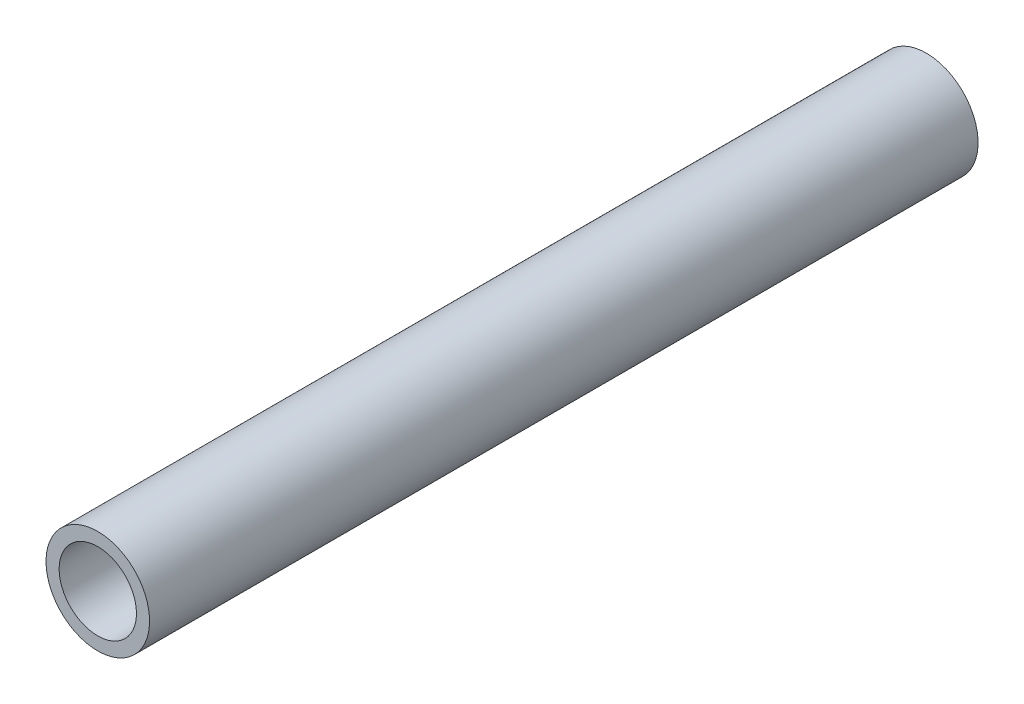
from build123d import *

# Parameters (mm, degrees)
SKETCH1_R           = 9.525
SKETCH1_R_2         = 7.112
BOSS_EXTRUDE1_DEPTH = 152.4


with BuildPart() as part:
    # Sketch1 → Boss-Extrude1 (new body)
    with BuildSketch(Plane.XY):
        with Locations(Location((0, 0, 0), (0, 0, 180))):
            Circle(SKETCH1_R)
        with Locations(Location((0, 0, 0), (0, 0, 180))):
            Circle(SKETCH1_R_2, mode=Mode.SUBTRACT)
    extrude(amount=BOSS_EXTRUDE1_DEPTH)


solid = part.part
